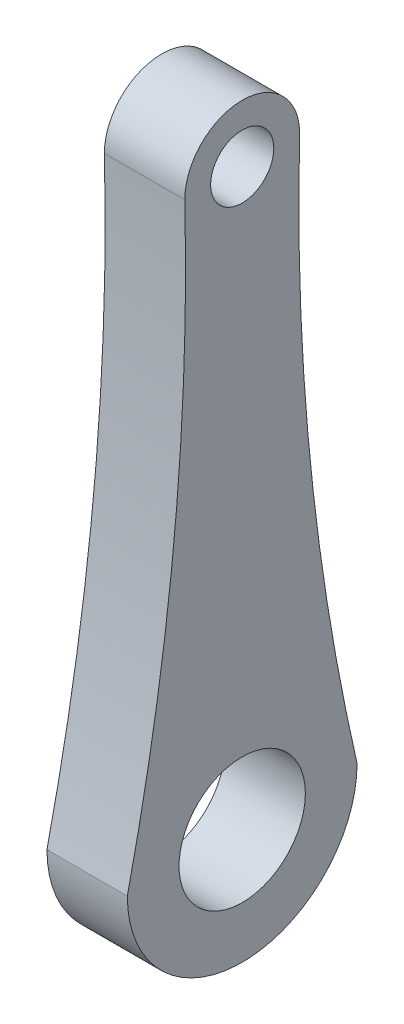
from build123d import *

# Parameters (mm, degrees)
SKETCH1_R             = 5
BOSS_EXTRUDE1_DEPTH   = 7
M10_CLEARANCE_HOLE1_D = 11
M5_CLEARANCE_HOLE1_D  = 5.5


with BuildPart() as part:
    # Sketch1 → Boss-Extrude1 (new body)
    with BuildSketch(Plane(origin=(0, 0, 0), x_dir=(0, 0, -1), z_dir=(1, 0, 0))):
        with Locations((0, 50)):
            Circle(SKETCH1_R)
        with BuildLine():
            ThreePointArc((-4.99342402, 49.743647589), (-5.733969822, 26.838261478), (-9.089996824, 4.167968058))
            ThreePointArc((-9.089996824, 4.167968058), (0, 10), (9.089996824, 4.167968058))
            ThreePointArc((9.089996824, 4.167968058), (5.733969822, 26.838261478), (4.99342402, 49.743647589))
            ThreePointArc((4.99342402, 49.743647589), (0, 45), (-4.99342402, 49.743647589))
        make_face()
        with BuildLine():
            ThreePointArc((-9.089996824, 4.167968058), (-9.533884852, 2.081557577), (-10, 0))
            ThreePointArc((-10, 0), (0, -10), (10, 0))
            ThreePointArc((10, 0), (9.533884852, 2.081557577), (9.089996824, 4.167968058))
            ThreePointArc((9.089996824, 4.167968058), (0, 10), (-9.089996824, 4.167968058))
        make_face()
    extrude(amount=BOSS_EXTRUDE1_DEPTH)

    # M10 Clearance Hole1 (through all)
    with Locations(Plane(origin=(7, 0, 0), x_dir=(0, 0, 1), z_dir=(1, 0, 0))):
        with Locations((0, 0)):
            Hole(M10_CLEARANCE_HOLE1_D / 2)

    # M5 Clearance Hole1 (through all)
    with Locations(Plane(origin=(7, 50, 0), x_dir=(0, 0, 1), z_dir=(1, 0, 0))):
        with Locations((0, 0)):
            Hole(M5_CLEARANCE_HOLE1_D / 2)


solid = part.part
